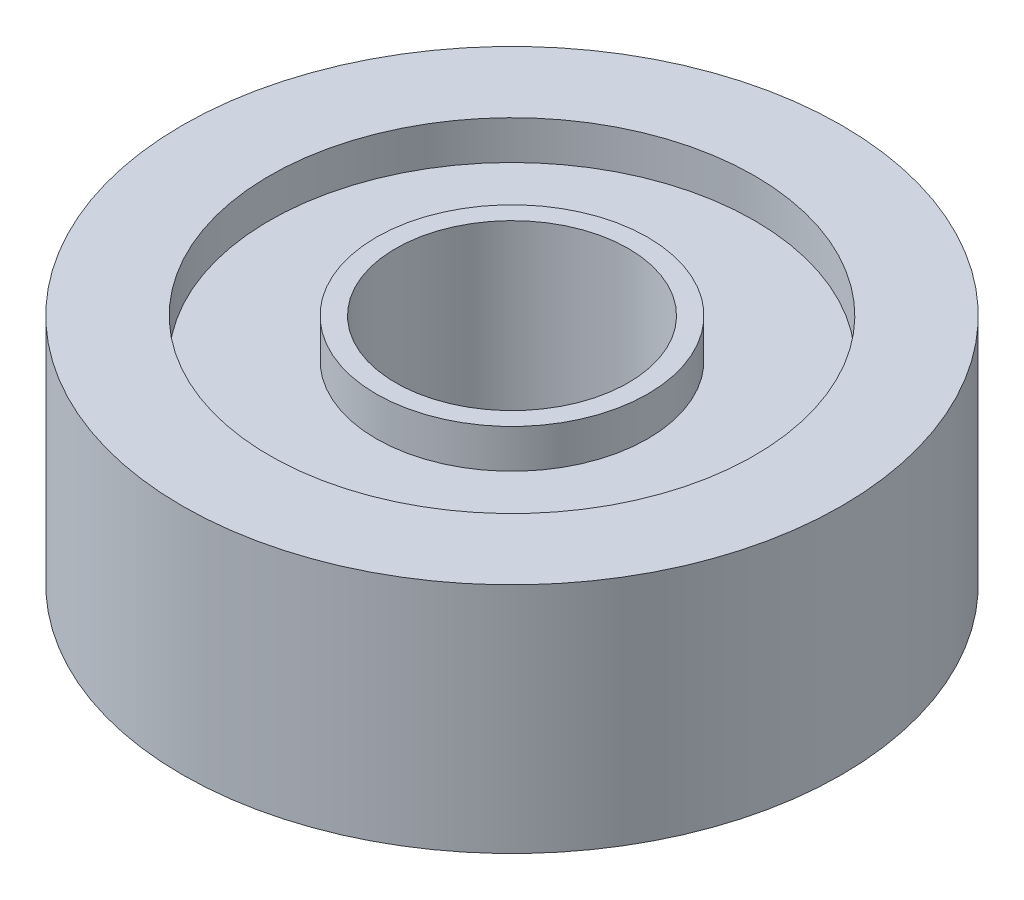
from build123d import *


with BuildPart() as part:
    # Sketch1 → Revolve1 (revolve)
    with BuildSketch(Plane.XY, mode=Mode.PRIVATE) as revolve1_sk:
        Polygon((-3, 0), (-3, 6), (-3.5, 6), (-3.5, 5), (-6.25, 5), (-6.25, 6), (-8.5, 6), (-8.5, 0), align=None)
    revolve(revolve1_sk.sketch.rotate(Axis((0, 0, 0), (0, 1, 0)), 270), axis=Axis((0, 0, 0), (0, 1, 0)))


solid = part.part
